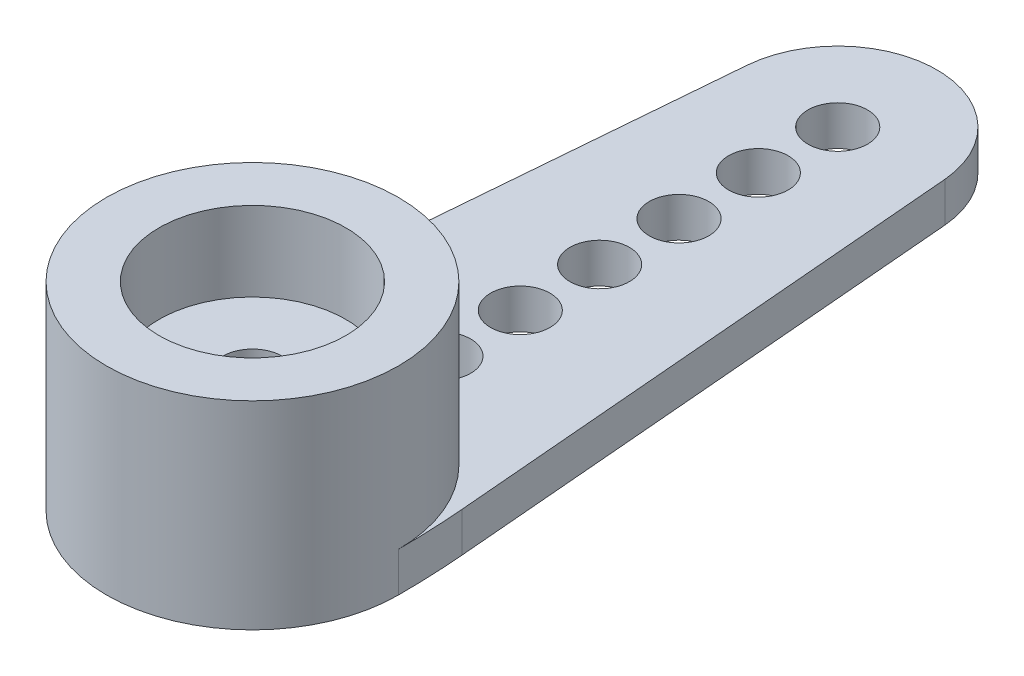
from build123d import *
from build123d.topology import SkipClean

# Parameters (mm, degrees)
SKETCH1_R           = 0.75
BOSS_EXTRUDE1_DEPTH = 1
SKETCH2_R           = 3.67931812
BOSS_EXTRUDE2_DEPTH = 5
SKETCH2_3_R         = 1.5
CUT_EXTRUDE1_DEPTH  = 0.5
SKETCH1_2_R         = 0.75
CUT_EXTRUDE2_DEPTH  = 19.333027078
SKETCH3_R           = 2.355
CUT_EXTRUDE3_DEPTH  = 2


with BuildPart() as part:
    # Sketch1 → Boss-Extrude1 (new body)
    with BuildSketch(Plane(origin=(0, 0, 0), x_dir=(1, 0, 0), z_dir=(0, 1, 0))):
        with BuildLine():
            ThreePointArc((2.49119588, 14.959626071), (0, 17.25), (-2.49119588, 14.959626071))
            Line((-2.49119588, 14.959626071), (-3.608885156, 1.677008569))
            ThreePointArc((-3.608885156, 1.677008569), (-3.66170212, 0.839243514), (-3.67931812, 4.9e-08))
            ThreePointArc((-3.67931812, 4.9e-08), (-2.4e-08, -3.67931812), (3.67931812, 0))
            ThreePointArc((3.67931812, 0), (3.661702121, 0.83924349), (3.608885156, 1.677008569))
            Line((3.608885156, 1.677008569), (2.49119588, 14.959626071))
        make_face()
        with Locations((0, 4.75)):
            Circle(SKETCH1_R, mode=Mode.SUBTRACT)
        with Locations((0, 6.75)):
            Circle(SKETCH1_R, mode=Mode.SUBTRACT)
        with Locations((0, 8.75)):
            Circle(SKETCH1_R, mode=Mode.SUBTRACT)
        with Locations((0, 10.75)):
            Circle(SKETCH1_R, mode=Mode.SUBTRACT)
        with Locations((0, 12.75)):
            Circle(SKETCH1_R, mode=Mode.SUBTRACT)
        with Locations((0, 14.75)):
            Circle(SKETCH1_R, mode=Mode.SUBTRACT)
        Circle(SKETCH1_R, mode=Mode.SUBTRACT)
    extrude(amount=BOSS_EXTRUDE1_DEPTH)

    # Sketch2 → Boss-Extrude2 (add)
    with SkipClean():  # the faces are left unmerged after this step: merging them gives an invalid solid
        with BuildSketch(Plane.XZ):
            Circle(SKETCH2_R)
        extrude(amount=-BOSS_EXTRUDE2_DEPTH)

    # Sketch2<3> → Cut-Extrude1 (cut)
    with SkipClean():  # the faces are left unmerged after this step: merging them gives an invalid solid
        with BuildSketch(Plane.XZ):
            Circle(SKETCH2_3_R)
        extrude(amount=-CUT_EXTRUDE1_DEPTH, mode=Mode.SUBTRACT)

    # Sketch1<2> → Cut-Extrude2 (cut, through all)
    with SkipClean():  # the faces are left unmerged after this step: merging them gives an invalid solid
        with BuildSketch(Plane(origin=(0, 0, 0), x_dir=(1, 0, 0), z_dir=(0, 1, 0))):
            Circle(SKETCH1_2_R)
        extrude(amount=CUT_EXTRUDE2_DEPTH, mode=Mode.SUBTRACT)

    # Sketch3 → Cut-Extrude3 (cut)
    with SkipClean():  # the faces are left unmerged after this step: merging them gives an invalid solid
        with BuildSketch(Plane(origin=(0, 5, 0), x_dir=(1, 0, 0), z_dir=(0, 1, 0))):
            Circle(SKETCH3_R)
        extrude(amount=-CUT_EXTRUDE3_DEPTH, mode=Mode.SUBTRACT)


solid = part.part
